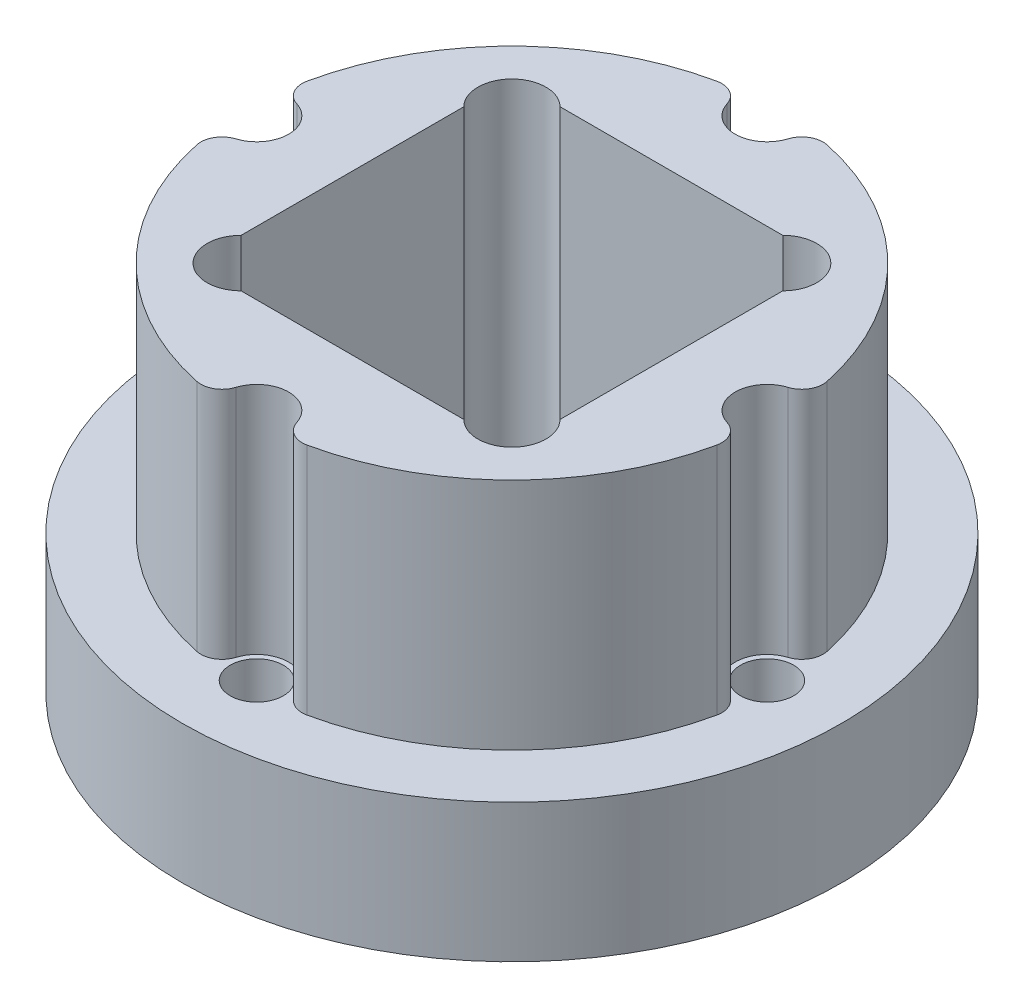
from build123d import *

# Parameters (mm, degrees)
SKETCH_2_R          = 1.6
SKETCH_2_W          = 15
SKETCH_2_H          = 15
CUT_EXTRUDE_1_DEPTH = 29.049064156
HOLE_WIZARD_M3_1_D  = 2.5
SKETCH_6_R          = 1.5
CUT_EXTRUDE_2_DEPTH = 11
FILLET_1_R          = 1


with BuildPart() as part:
    # 草图1 → 旋转1 (revolve)
    with BuildSketch(Plane(origin=(0, 0, 0), x_dir=(0, 0, -1), z_dir=(1, 0, 0)), mode=Mode.PRIVATE) as revolve_1_sk:
        Polygon((0, 0), (15.5, 0), (15.5, 6.5), (12.5, 6.5), (12.5, 17.5), (0, 17.5), align=None)
    revolve(revolve_1_sk.sketch.rotate(Axis((0, 25.607258106, 0), (0, -1, 0)), 180), axis=Axis((0, 25.607258106, 0), (0, -1, 0)))

    # 草图2 → 切除-拉伸1 (cut, through all)
    with BuildSketch(Plane(origin=(0, 0, 0), x_dir=(1, 0, 0), z_dir=(0, 1, 0))):
        with Locations((6.36862915, 6.36862915)):
            Circle(SKETCH_2_R)
        with Locations((-6.36862915, 6.36862915)):
            Circle(SKETCH_2_R)
        with Locations((-6.36862915, -6.36862915)):
            Circle(SKETCH_2_R)
        with Locations((6.36862915, -6.36862915)):
            Circle(SKETCH_2_R)
        Rectangle(SKETCH_2_W, SKETCH_2_H)
    extrude(amount=CUT_EXTRUDE_1_DEPTH, mode=Mode.SUBTRACT)

    # M3 螺纹孔1 (through all)
    with Locations(Plane(origin=(0, 0, 0), x_dir=(-1, 0, 0), z_dir=(0, -1, 0))):
        with Locations((12, 0), (0, 12), (-12, 0), (0, -12)):
            Hole(HOLE_WIZARD_M3_1_D / 2)

    # 草图6 → 切除-拉伸2 (cut)
    with BuildSketch(Plane(origin=(0, 17.5, 0), x_dir=(1, 0, 0), z_dir=(0, 1, 0))):
        with Locations((-12, 0)):
            Circle(SKETCH_6_R)
        with Locations((0, 12)):
            Circle(SKETCH_6_R)
        with Locations((12, 0)):
            Circle(SKETCH_6_R)
        with Locations((0, -12)):
            Circle(SKETCH_6_R)
    extrude(amount=-CUT_EXTRUDE_2_DEPTH, mode=Mode.SUBTRACT)

    # 圆角1
    fillet_1_edges = [part.edges().sort_by_distance(p)[0] for p in [
        (-12.416666667, 12, 1.440968039),
        (-12.416666667, 12, -1.440968039),
        (-1.440968039, 12, -12.416666667),
        (1.440968039, 12, -12.416666667),
        (12.416666667, 12, -1.440968039),
        (12.416666667, 12, 1.440968039),
        (-1.440968039, 12, 12.416666667),
        (1.440968039, 12, 12.416666667),
    ]]
    fillet(fillet_1_edges, radius=FILLET_1_R)


solid = part.part
